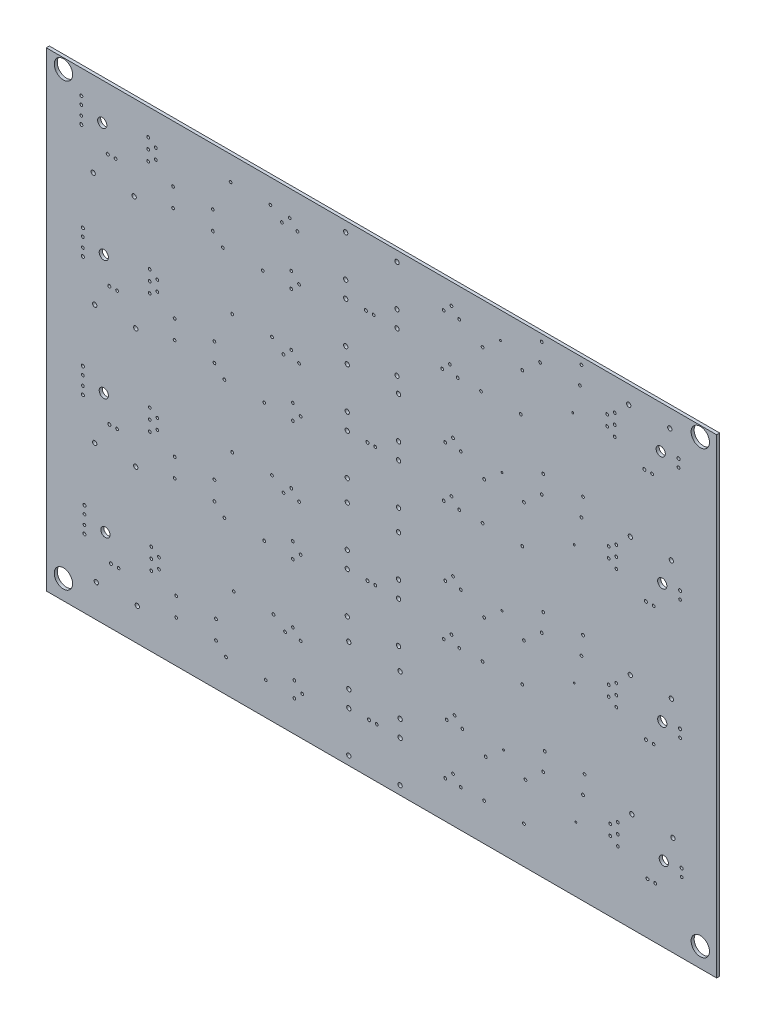
from build123d import *

# Parameters (mm, degrees)
MODEL_W             = 218.948
MODEL_H             = 153.67
MODEL_R             = 2.999999994
MODEL_R_2           = 0.30000001
MODEL_R_3           = 0.6985
MODEL_R_4           = 0.4445
MODEL_R_5           = 0.497459
MODEL_R_6           = 1.502791
MODEL_R_7           = 0.449999989
BOSS_EXTRUDE1_DEPTH = 1


with BuildPart() as part:
    # Model → Boss-Extrude1 (new body)
    with BuildSketch(Plane.XY):
        with Locations((107.188, 4.699)):
            Rectangle(MODEL_W, MODEL_H)
        with Locations((211.328, 78.232)):
            Circle(MODEL_R, mode=Mode.SUBTRACT)
        with Locations((211.328, -65.786)):
            Circle(MODEL_R, mode=Mode.SUBTRACT)
        with Locations((3.302, -65.786)):
            Circle(MODEL_R, mode=Mode.SUBTRACT)
        with Locations((3.302, 78.232)):
            Circle(MODEL_R, mode=Mode.SUBTRACT)
        with Locations((169.672, 64.262)):
            Circle(MODEL_R_2, mode=Mode.SUBTRACT)
        with Locations((146.05, 72.898)):
            Circle(MODEL_R_2, mode=Mode.SUBTRACT)
        with Locations((95.504, 46.036000003)):
            Circle(MODEL_R_3, mode=Mode.SUBTRACT)
        with Locations((95.504, 59.436)):
            Circle(MODEL_R_3, mode=Mode.SUBTRACT)
        with Locations((112.268, 46.036000003)):
            Circle(MODEL_R_3, mode=Mode.SUBTRACT)
        with Locations((112.268, 59.436)):
            Circle(MODEL_R_3, mode=Mode.SUBTRACT)
        with Locations((80.264, 55.88)):
            Circle(MODEL_R_4, mode=Mode.SUBTRACT)
        with Locations((77.724, 58.42)):
            Circle(MODEL_R_4, mode=Mode.SUBTRACT)
        with Locations((77.724, 53.34)):
            Circle(MODEL_R_4, mode=Mode.SUBTRACT)
        with Locations((129.54, 57.912)):
            Circle(MODEL_R_4, mode=Mode.SUBTRACT)
        with Locations((127, 55.372)):
            Circle(MODEL_R_4, mode=Mode.SUBTRACT)
        with Locations((132.08, 55.372)):
            Circle(MODEL_R_4, mode=Mode.SUBTRACT)
        with Locations((26.416, 53.848)):
            Circle(MODEL_R_3, mode=Mode.SUBTRACT)
        with Locations((13.016000003, 53.848)):
            Circle(MODEL_R_3, mode=Mode.SUBTRACT)
        with Locations((102.108, 59.436)):
            Circle(MODEL_R_5, mode=Mode.SUBTRACT)
        with Locations((104.648, 59.436)):
            Circle(MODEL_R_4, mode=Mode.SUBTRACT)
        with Locations((30.988000991, 69.447831996)):
            Circle(MODEL_R_4, mode=Mode.SUBTRACT)
        with Locations((30.988000991, 72.855665007)):
            Circle(MODEL_R_4, mode=Mode.SUBTRACT)
        with Locations((33.485666988, 71.141165007)):
            Circle(MODEL_R_4, mode=Mode.SUBTRACT)
        with Locations((30.988000991, 66.039999009)):
            Circle(MODEL_R_4, mode=Mode.SUBTRACT)
        with Locations((33.485666988, 67.754499009)):
            Circle(MODEL_R_4, mode=Mode.SUBTRACT)
        with Locations((15.980834002, 69.447831996)):
            Circle(MODEL_R_6, mode=Mode.SUBTRACT)
        with Locations((183.387999009, 64.304334993)):
            Circle(MODEL_R_4, mode=Mode.SUBTRACT)
        with Locations((180.890333012, 66.018834993)):
            Circle(MODEL_R_4, mode=Mode.SUBTRACT)
        with Locations((183.387999009, 71.120000991)):
            Circle(MODEL_R_4, mode=Mode.SUBTRACT)
        with Locations((180.890333012, 69.405500991)):
            Circle(MODEL_R_4, mode=Mode.SUBTRACT)
        with Locations((183.387999009, 67.712168004)):
            Circle(MODEL_R_4, mode=Mode.SUBTRACT)
        with Locations((198.395165998, 67.712168004)):
            Circle(MODEL_R_6, mode=Mode.SUBTRACT)
        with Locations((187.96, 75.692)):
            Circle(MODEL_R_3, mode=Mode.SUBTRACT)
        with Locations((201.359999997, 75.692)):
            Circle(MODEL_R_3, mode=Mode.SUBTRACT)
        with Locations((95.504, 78.232)):
            Circle(MODEL_R_3, mode=Mode.SUBTRACT)
        with Locations((95.504, 64.832000003)):
            Circle(MODEL_R_3, mode=Mode.SUBTRACT)
        with Locations((112.268, 78.232)):
            Circle(MODEL_R_3, mode=Mode.SUBTRACT)
        with Locations((112.268, 64.832000003)):
            Circle(MODEL_R_3, mode=Mode.SUBTRACT)
        with Locations((77.216, 73.152)):
            Circle(MODEL_R_4, mode=Mode.SUBTRACT)
        with Locations((74.676, 70.612)):
            Circle(MODEL_R_4, mode=Mode.SUBTRACT)
        with Locations((79.756, 70.612)):
            Circle(MODEL_R_4, mode=Mode.SUBTRACT)
        with Locations((130.048, 74.676)):
            Circle(MODEL_R_4, mode=Mode.SUBTRACT)
        with Locations((132.588, 72.136)):
            Circle(MODEL_R_4, mode=Mode.SUBTRACT)
        with Locations((127.508, 72.136)):
            Circle(MODEL_R_4, mode=Mode.SUBTRACT)
        with Locations((172.51200001, 79.248)):
            Circle(MODEL_R_7, mode=Mode.SUBTRACT)
        with Locations((159.512, 79.248)):
            Circle(MODEL_R_7, mode=Mode.SUBTRACT)
        with Locations((68.37200001, 53.848)):
            Circle(MODEL_R_7, mode=Mode.SUBTRACT)
        with Locations((55.372, 53.848)):
            Circle(MODEL_R_7, mode=Mode.SUBTRACT)
        with Locations((152.70000001, 55.372)):
            Circle(MODEL_R_7, mode=Mode.SUBTRACT)
        with Locations((139.7, 55.372)):
            Circle(MODEL_R_7, mode=Mode.SUBTRACT)
        with Locations((52.11600001, 56.896)):
            Circle(MODEL_R_7, mode=Mode.SUBTRACT)
        with Locations((39.116, 56.896)):
            Circle(MODEL_R_7, mode=Mode.SUBTRACT)
        with Locations((52.11600001, 62.992)):
            Circle(MODEL_R_7, mode=Mode.SUBTRACT)
        with Locations((39.116, 62.992)):
            Circle(MODEL_R_7, mode=Mode.SUBTRACT)
        with Locations((153.20800001, 68.072)):
            Circle(MODEL_R_7, mode=Mode.SUBTRACT)
        with Locations((140.208, 68.072)):
            Circle(MODEL_R_7, mode=Mode.SUBTRACT)
        with Locations((70.91200001, 73.66)):
            Circle(MODEL_R_7, mode=Mode.SUBTRACT)
        with Locations((57.912, 73.66)):
            Circle(MODEL_R_7, mode=Mode.SUBTRACT)
        with Locations((172.00400001, 73.152)):
            Circle(MODEL_R_7, mode=Mode.SUBTRACT)
        with Locations((159.004, 73.152)):
            Circle(MODEL_R_7, mode=Mode.SUBTRACT)
        with Locations((96.012, 8.952000003)):
            Circle(MODEL_R_3, mode=Mode.SUBTRACT)
        with Locations((96.012, 22.352)):
            Circle(MODEL_R_3, mode=Mode.SUBTRACT)
        with Locations((112.776, 8.952000003)):
            Circle(MODEL_R_3, mode=Mode.SUBTRACT)
        with Locations((112.776, 22.352)):
            Circle(MODEL_R_3, mode=Mode.SUBTRACT)
        with Locations((80.772, 18.796)):
            Circle(MODEL_R_4, mode=Mode.SUBTRACT)
        with Locations((78.232, 21.336)):
            Circle(MODEL_R_4, mode=Mode.SUBTRACT)
        with Locations((78.232, 16.256)):
            Circle(MODEL_R_4, mode=Mode.SUBTRACT)
        with Locations((68.88000001, 16.764)):
            Circle(MODEL_R_7, mode=Mode.SUBTRACT)
        with Locations((55.88, 16.764)):
            Circle(MODEL_R_7, mode=Mode.SUBTRACT)
        with Locations((130.048, 20.828)):
            Circle(MODEL_R_4, mode=Mode.SUBTRACT)
        with Locations((127.508, 18.288)):
            Circle(MODEL_R_4, mode=Mode.SUBTRACT)
        with Locations((132.588, 18.288)):
            Circle(MODEL_R_4, mode=Mode.SUBTRACT)
        with Locations((153.20800001, 18.288)):
            Circle(MODEL_R_7, mode=Mode.SUBTRACT)
        with Locations((140.208, 18.288)):
            Circle(MODEL_R_7, mode=Mode.SUBTRACT)
        with Locations((13.524000003, 16.764)):
            Circle(MODEL_R_3, mode=Mode.SUBTRACT)
        with Locations((26.924, 16.764)):
            Circle(MODEL_R_3, mode=Mode.SUBTRACT)
        with Locations((52.62400001, 19.812)):
            Circle(MODEL_R_7, mode=Mode.SUBTRACT)
        with Locations((39.624, 19.812)):
            Circle(MODEL_R_7, mode=Mode.SUBTRACT)
        with Locations((102.616, 22.352)):
            Circle(MODEL_R_5, mode=Mode.SUBTRACT)
        with Locations((105.156, 22.352)):
            Circle(MODEL_R_4, mode=Mode.SUBTRACT)
        with Locations((18.288, 24.384)):
            Circle(MODEL_R_5, mode=Mode.SUBTRACT)
        with Locations((20.828, 24.384)):
            Circle(MODEL_R_4, mode=Mode.SUBTRACT)
        with Locations((52.62400001, 25.908)):
            Circle(MODEL_R_7, mode=Mode.SUBTRACT)
        with Locations((39.624, 25.908)):
            Circle(MODEL_R_7, mode=Mode.SUBTRACT)
        with Locations((31.496000991, 32.363831996)):
            Circle(MODEL_R_4, mode=Mode.SUBTRACT)
        with Locations((31.496000991, 35.771665007)):
            Circle(MODEL_R_4, mode=Mode.SUBTRACT)
        with Locations((33.993666988, 34.057165007)):
            Circle(MODEL_R_4, mode=Mode.SUBTRACT)
        with Locations((31.496000991, 28.955999009)):
            Circle(MODEL_R_4, mode=Mode.SUBTRACT)
        with Locations((33.993666988, 30.670499009)):
            Circle(MODEL_R_4, mode=Mode.SUBTRACT)
        with Locations((16.488834002, 32.363831996)):
            Circle(MODEL_R_6, mode=Mode.SUBTRACT)
        with Locations((96.012, 27.748000003)):
            Circle(MODEL_R_3, mode=Mode.SUBTRACT)
        with Locations((96.012, 41.148)):
            Circle(MODEL_R_3, mode=Mode.SUBTRACT)
        with Locations((112.776, 27.748000003)):
            Circle(MODEL_R_3, mode=Mode.SUBTRACT)
        with Locations((112.776, 41.148)):
            Circle(MODEL_R_3, mode=Mode.SUBTRACT)
        with Locations((170.18, 27.178)):
            Circle(MODEL_R_2, mode=Mode.SUBTRACT)
        with Locations((183.895999009, 27.220334993)):
            Circle(MODEL_R_4, mode=Mode.SUBTRACT)
        with Locations((181.398333012, 28.934834993)):
            Circle(MODEL_R_4, mode=Mode.SUBTRACT)
        with Locations((183.895999009, 34.036000991)):
            Circle(MODEL_R_4, mode=Mode.SUBTRACT)
        with Locations((181.398333012, 32.321500991)):
            Circle(MODEL_R_4, mode=Mode.SUBTRACT)
        with Locations((183.895999009, 30.628168004)):
            Circle(MODEL_R_4, mode=Mode.SUBTRACT)
        with Locations((198.903165998, 30.628168004)):
            Circle(MODEL_R_6, mode=Mode.SUBTRACT)
        with Locations((77.724, 36.068)):
            Circle(MODEL_R_4, mode=Mode.SUBTRACT)
        with Locations((75.184, 33.528)):
            Circle(MODEL_R_4, mode=Mode.SUBTRACT)
        with Locations((80.264, 33.528)):
            Circle(MODEL_R_4, mode=Mode.SUBTRACT)
        with Locations((153.71600001, 30.988)):
            Circle(MODEL_R_7, mode=Mode.SUBTRACT)
        with Locations((140.716, 30.988)):
            Circle(MODEL_R_7, mode=Mode.SUBTRACT)
        with Locations((128.016, 35.052)):
            Circle(MODEL_R_4, mode=Mode.SUBTRACT)
        with Locations((130.556, 37.592)):
            Circle(MODEL_R_4, mode=Mode.SUBTRACT)
        with Locations((133.096, 35.052)):
            Circle(MODEL_R_4, mode=Mode.SUBTRACT)
        with Locations((9.652, 34.036)):
            Circle(MODEL_R_4, mode=Mode.SUBTRACT)
        with Locations((9.652, 36.576)):
            Circle(MODEL_R_5, mode=Mode.SUBTRACT)
        with Locations((172.51200001, 36.068)):
            Circle(MODEL_R_7, mode=Mode.SUBTRACT)
        with Locations((159.512, 36.068)):
            Circle(MODEL_R_7, mode=Mode.SUBTRACT)
        with Locations((71.42000001, 36.576)):
            Circle(MODEL_R_7, mode=Mode.SUBTRACT)
        with Locations((58.42, 36.576)):
            Circle(MODEL_R_7, mode=Mode.SUBTRACT)
        with Locations((146.558, 35.814)):
            Circle(MODEL_R_2, mode=Mode.SUBTRACT)
        with Locations((188.468, 38.608)):
            Circle(MODEL_R_3, mode=Mode.SUBTRACT)
        with Locations((201.867999997, 38.608)):
            Circle(MODEL_R_3, mode=Mode.SUBTRACT)
        with Locations((173.02000001, 42.164)):
            Circle(MODEL_R_7, mode=Mode.SUBTRACT)
        with Locations((160.02, 42.164)):
            Circle(MODEL_R_7, mode=Mode.SUBTRACT)
        with Locations((96.012, -30.163999997)):
            Circle(MODEL_R_3, mode=Mode.SUBTRACT)
        with Locations((96.012, -16.764)):
            Circle(MODEL_R_3, mode=Mode.SUBTRACT)
        with Locations((112.776, -30.163999997)):
            Circle(MODEL_R_3, mode=Mode.SUBTRACT)
        with Locations((112.776, -16.764)):
            Circle(MODEL_R_3, mode=Mode.SUBTRACT)
        with Locations((80.772, -20.32)):
            Circle(MODEL_R_4, mode=Mode.SUBTRACT)
        with Locations((78.232, -17.78)):
            Circle(MODEL_R_4, mode=Mode.SUBTRACT)
        with Locations((78.232, -22.86)):
            Circle(MODEL_R_4, mode=Mode.SUBTRACT)
        with Locations((68.88000001, -22.352)):
            Circle(MODEL_R_7, mode=Mode.SUBTRACT)
        with Locations((55.88, -22.352)):
            Circle(MODEL_R_7, mode=Mode.SUBTRACT)
        with Locations((130.048, -18.288)):
            Circle(MODEL_R_4, mode=Mode.SUBTRACT)
        with Locations((127.508, -20.828)):
            Circle(MODEL_R_4, mode=Mode.SUBTRACT)
        with Locations((132.588, -20.828)):
            Circle(MODEL_R_4, mode=Mode.SUBTRACT)
        with Locations((153.20800001, -20.828)):
            Circle(MODEL_R_7, mode=Mode.SUBTRACT)
        with Locations((140.208, -20.828)):
            Circle(MODEL_R_7, mode=Mode.SUBTRACT)
        with Locations((13.524000003, -22.352)):
            Circle(MODEL_R_3, mode=Mode.SUBTRACT)
        with Locations((26.924, -22.352)):
            Circle(MODEL_R_3, mode=Mode.SUBTRACT)
        with Locations((52.62400001, -19.304)):
            Circle(MODEL_R_7, mode=Mode.SUBTRACT)
        with Locations((39.624, -19.304)):
            Circle(MODEL_R_7, mode=Mode.SUBTRACT)
        with Locations((102.616, -16.764)):
            Circle(MODEL_R_5, mode=Mode.SUBTRACT)
        with Locations((105.156, -16.764)):
            Circle(MODEL_R_4, mode=Mode.SUBTRACT)
        with Locations((18.288, -14.732)):
            Circle(MODEL_R_5, mode=Mode.SUBTRACT)
        with Locations((20.828, -14.732)):
            Circle(MODEL_R_4, mode=Mode.SUBTRACT)
        with Locations((52.62400001, -13.208)):
            Circle(MODEL_R_7, mode=Mode.SUBTRACT)
        with Locations((39.624, -13.208)):
            Circle(MODEL_R_7, mode=Mode.SUBTRACT)
        with Locations((31.496000991, -6.752168004)):
            Circle(MODEL_R_4, mode=Mode.SUBTRACT)
        with Locations((31.496000991, -3.344334993)):
            Circle(MODEL_R_4, mode=Mode.SUBTRACT)
        with Locations((33.993666988, -5.058834993)):
            Circle(MODEL_R_4, mode=Mode.SUBTRACT)
        with Locations((31.496000991, -10.160000991)):
            Circle(MODEL_R_4, mode=Mode.SUBTRACT)
        with Locations((33.993666988, -8.445500991)):
            Circle(MODEL_R_4, mode=Mode.SUBTRACT)
        with Locations((16.488834002, -6.752168004)):
            Circle(MODEL_R_6, mode=Mode.SUBTRACT)
        with Locations((96.012, -11.367999997)):
            Circle(MODEL_R_3, mode=Mode.SUBTRACT)
        with Locations((96.012, 2.032)):
            Circle(MODEL_R_3, mode=Mode.SUBTRACT)
        with Locations((112.776, -11.367999997)):
            Circle(MODEL_R_3, mode=Mode.SUBTRACT)
        with Locations((112.776, 2.032)):
            Circle(MODEL_R_3, mode=Mode.SUBTRACT)
        with Locations((170.18, -11.938)):
            Circle(MODEL_R_2, mode=Mode.SUBTRACT)
        with Locations((183.895999009, -11.895665007)):
            Circle(MODEL_R_4, mode=Mode.SUBTRACT)
        with Locations((181.398333012, -10.181165007)):
            Circle(MODEL_R_4, mode=Mode.SUBTRACT)
        with Locations((183.895999009, -5.079999009)):
            Circle(MODEL_R_4, mode=Mode.SUBTRACT)
        with Locations((181.398333012, -6.794499009)):
            Circle(MODEL_R_4, mode=Mode.SUBTRACT)
        with Locations((183.895999009, -8.487831996)):
            Circle(MODEL_R_4, mode=Mode.SUBTRACT)
        with Locations((198.903165998, -8.487831996)):
            Circle(MODEL_R_6, mode=Mode.SUBTRACT)
        with Locations((77.724, -3.048)):
            Circle(MODEL_R_4, mode=Mode.SUBTRACT)
        with Locations((75.184, -5.588)):
            Circle(MODEL_R_4, mode=Mode.SUBTRACT)
        with Locations((80.264, -5.588)):
            Circle(MODEL_R_4, mode=Mode.SUBTRACT)
        with Locations((153.71600001, -8.128)):
            Circle(MODEL_R_7, mode=Mode.SUBTRACT)
        with Locations((140.716, -8.128)):
            Circle(MODEL_R_7, mode=Mode.SUBTRACT)
        with Locations((128.016, -4.064)):
            Circle(MODEL_R_4, mode=Mode.SUBTRACT)
        with Locations((130.556, -1.524)):
            Circle(MODEL_R_4, mode=Mode.SUBTRACT)
        with Locations((133.096, -4.064)):
            Circle(MODEL_R_4, mode=Mode.SUBTRACT)
        with Locations((9.652, -5.08)):
            Circle(MODEL_R_4, mode=Mode.SUBTRACT)
        with Locations((9.652, -2.54)):
            Circle(MODEL_R_5, mode=Mode.SUBTRACT)
        with Locations((172.51200001, -3.048)):
            Circle(MODEL_R_7, mode=Mode.SUBTRACT)
        with Locations((159.512, -3.048)):
            Circle(MODEL_R_7, mode=Mode.SUBTRACT)
        with Locations((71.42000001, -2.54)):
            Circle(MODEL_R_7, mode=Mode.SUBTRACT)
        with Locations((58.42, -2.54)):
            Circle(MODEL_R_7, mode=Mode.SUBTRACT)
        with Locations((146.558, -3.302)):
            Circle(MODEL_R_2, mode=Mode.SUBTRACT)
        with Locations((188.468, -0.508)):
            Circle(MODEL_R_3, mode=Mode.SUBTRACT)
        with Locations((201.867999997, -0.508)):
            Circle(MODEL_R_3, mode=Mode.SUBTRACT)
        with Locations((173.02000001, 3.048)):
            Circle(MODEL_R_7, mode=Mode.SUBTRACT)
        with Locations((160.02, 3.048)):
            Circle(MODEL_R_7, mode=Mode.SUBTRACT)
        with Locations((96.52, -69.279999997)):
            Circle(MODEL_R_3, mode=Mode.SUBTRACT)
        with Locations((96.52, -55.88)):
            Circle(MODEL_R_3, mode=Mode.SUBTRACT)
        with Locations((113.284, -69.279999997)):
            Circle(MODEL_R_3, mode=Mode.SUBTRACT)
        with Locations((113.284, -55.88)):
            Circle(MODEL_R_3, mode=Mode.SUBTRACT)
        with Locations((81.28, -59.436)):
            Circle(MODEL_R_4, mode=Mode.SUBTRACT)
        with Locations((78.74, -56.896)):
            Circle(MODEL_R_4, mode=Mode.SUBTRACT)
        with Locations((78.74, -61.976)):
            Circle(MODEL_R_4, mode=Mode.SUBTRACT)
        with Locations((69.38800001, -61.468)):
            Circle(MODEL_R_7, mode=Mode.SUBTRACT)
        with Locations((56.388, -61.468)):
            Circle(MODEL_R_7, mode=Mode.SUBTRACT)
        with Locations((130.556, -57.404)):
            Circle(MODEL_R_4, mode=Mode.SUBTRACT)
        with Locations((128.016, -59.944)):
            Circle(MODEL_R_4, mode=Mode.SUBTRACT)
        with Locations((133.096, -59.944)):
            Circle(MODEL_R_4, mode=Mode.SUBTRACT)
        with Locations((153.71600001, -59.944)):
            Circle(MODEL_R_7, mode=Mode.SUBTRACT)
        with Locations((140.716, -59.944)):
            Circle(MODEL_R_7, mode=Mode.SUBTRACT)
        with Locations((14.032000003, -61.468)):
            Circle(MODEL_R_3, mode=Mode.SUBTRACT)
        with Locations((27.432, -61.468)):
            Circle(MODEL_R_3, mode=Mode.SUBTRACT)
        with Locations((53.13200001, -58.42)):
            Circle(MODEL_R_7, mode=Mode.SUBTRACT)
        with Locations((40.132, -58.42)):
            Circle(MODEL_R_7, mode=Mode.SUBTRACT)
        with Locations((53.13200001, -52.324)):
            Circle(MODEL_R_7, mode=Mode.SUBTRACT)
        with Locations((40.132, -52.324)):
            Circle(MODEL_R_7, mode=Mode.SUBTRACT)
        with Locations((32.004000991, -45.868168004)):
            Circle(MODEL_R_4, mode=Mode.SUBTRACT)
        with Locations((32.004000991, -42.460334993)):
            Circle(MODEL_R_4, mode=Mode.SUBTRACT)
        with Locations((34.501666988, -44.174834993)):
            Circle(MODEL_R_4, mode=Mode.SUBTRACT)
        with Locations((32.004000991, -49.276000991)):
            Circle(MODEL_R_4, mode=Mode.SUBTRACT)
        with Locations((34.501666988, -47.561500991)):
            Circle(MODEL_R_4, mode=Mode.SUBTRACT)
        with Locations((16.996834002, -45.868168004)):
            Circle(MODEL_R_6, mode=Mode.SUBTRACT)
        with Locations((96.52, -50.483999997)):
            Circle(MODEL_R_3, mode=Mode.SUBTRACT)
        with Locations((96.52, -37.084)):
            Circle(MODEL_R_3, mode=Mode.SUBTRACT)
        with Locations((113.284, -50.483999997)):
            Circle(MODEL_R_3, mode=Mode.SUBTRACT)
        with Locations((113.284, -37.084)):
            Circle(MODEL_R_3, mode=Mode.SUBTRACT)
        with Locations((170.688, -51.054)):
            Circle(MODEL_R_2, mode=Mode.SUBTRACT)
        with Locations((184.403999009, -51.011665007)):
            Circle(MODEL_R_4, mode=Mode.SUBTRACT)
        with Locations((181.906333012, -49.297165007)):
            Circle(MODEL_R_4, mode=Mode.SUBTRACT)
        with Locations((184.403999009, -44.195999009)):
            Circle(MODEL_R_4, mode=Mode.SUBTRACT)
        with Locations((181.906333012, -45.910499009)):
            Circle(MODEL_R_4, mode=Mode.SUBTRACT)
        with Locations((184.403999009, -47.603831996)):
            Circle(MODEL_R_4, mode=Mode.SUBTRACT)
        with Locations((199.411165998, -47.603831996)):
            Circle(MODEL_R_6, mode=Mode.SUBTRACT)
        with Locations((78.232, -42.164)):
            Circle(MODEL_R_4, mode=Mode.SUBTRACT)
        with Locations((75.692, -44.704)):
            Circle(MODEL_R_4, mode=Mode.SUBTRACT)
        with Locations((80.772, -44.704)):
            Circle(MODEL_R_4, mode=Mode.SUBTRACT)
        with Locations((154.22400001, -47.244)):
            Circle(MODEL_R_7, mode=Mode.SUBTRACT)
        with Locations((141.224, -47.244)):
            Circle(MODEL_R_7, mode=Mode.SUBTRACT)
        with Locations((128.524, -43.18)):
            Circle(MODEL_R_4, mode=Mode.SUBTRACT)
        with Locations((131.064, -40.64)):
            Circle(MODEL_R_4, mode=Mode.SUBTRACT)
        with Locations((133.604, -43.18)):
            Circle(MODEL_R_4, mode=Mode.SUBTRACT)
        with Locations((173.02000001, -42.164)):
            Circle(MODEL_R_7, mode=Mode.SUBTRACT)
        with Locations((160.02, -42.164)):
            Circle(MODEL_R_7, mode=Mode.SUBTRACT)
        with Locations((71.92800001, -41.656)):
            Circle(MODEL_R_7, mode=Mode.SUBTRACT)
        with Locations((58.928, -41.656)):
            Circle(MODEL_R_7, mode=Mode.SUBTRACT)
        with Locations((147.066, -42.418)):
            Circle(MODEL_R_2, mode=Mode.SUBTRACT)
        with Locations((188.976, -39.624)):
            Circle(MODEL_R_3, mode=Mode.SUBTRACT)
        with Locations((202.375999997, -39.624)):
            Circle(MODEL_R_3, mode=Mode.SUBTRACT)
        with Locations((173.52800001, -36.068)):
            Circle(MODEL_R_7, mode=Mode.SUBTRACT)
        with Locations((160.528, -36.068)):
            Circle(MODEL_R_7, mode=Mode.SUBTRACT)
        with Locations((103.124, -55.88)):
            Circle(MODEL_R_5, mode=Mode.SUBTRACT)
        with Locations((105.664, -55.88)):
            Circle(MODEL_R_4, mode=Mode.SUBTRACT)
        with Locations((10.16, -44.196)):
            Circle(MODEL_R_4, mode=Mode.SUBTRACT)
        with Locations((10.16, -41.656)):
            Circle(MODEL_R_5, mode=Mode.SUBTRACT)
        with Locations((18.796, -53.848)):
            Circle(MODEL_R_5, mode=Mode.SUBTRACT)
        with Locations((21.336, -53.848)):
            Circle(MODEL_R_4, mode=Mode.SUBTRACT)
        with Locations((196.596, -55.372)):
            Circle(MODEL_R_4, mode=Mode.SUBTRACT)
        with Locations((194.056, -55.372)):
            Circle(MODEL_R_5, mode=Mode.SUBTRACT)
        with Locations((205.232, -49.276)):
            Circle(MODEL_R_4, mode=Mode.SUBTRACT)
        with Locations((205.232, -46.736)):
            Circle(MODEL_R_5, mode=Mode.SUBTRACT)
        with Locations((196.088, -16.256)):
            Circle(MODEL_R_4, mode=Mode.SUBTRACT)
        with Locations((193.548, -16.256)):
            Circle(MODEL_R_5, mode=Mode.SUBTRACT)
        with Locations((204.724, -10.16)):
            Circle(MODEL_R_4, mode=Mode.SUBTRACT)
        with Locations((204.724, -7.62)):
            Circle(MODEL_R_5, mode=Mode.SUBTRACT)
        with Locations((204.724, 28.956)):
            Circle(MODEL_R_4, mode=Mode.SUBTRACT)
        with Locations((204.724, 31.496)):
            Circle(MODEL_R_5, mode=Mode.SUBTRACT)
        with Locations((196.088, 22.86)):
            Circle(MODEL_R_4, mode=Mode.SUBTRACT)
        with Locations((193.548, 22.86)):
            Circle(MODEL_R_5, mode=Mode.SUBTRACT)
        with Locations((9.144, 71.12)):
            Circle(MODEL_R_4, mode=Mode.SUBTRACT)
        with Locations((9.144, 73.66)):
            Circle(MODEL_R_5, mode=Mode.SUBTRACT)
        with Locations((17.78, 61.468)):
            Circle(MODEL_R_5, mode=Mode.SUBTRACT)
        with Locations((20.32, 61.468)):
            Circle(MODEL_R_4, mode=Mode.SUBTRACT)
        with Locations((195.58, 59.944)):
            Circle(MODEL_R_4, mode=Mode.SUBTRACT)
        with Locations((193.04, 59.944)):
            Circle(MODEL_R_5, mode=Mode.SUBTRACT)
        with Locations((204.216, 66.04)):
            Circle(MODEL_R_4, mode=Mode.SUBTRACT)
        with Locations((204.216, 68.58)):
            Circle(MODEL_R_5, mode=Mode.SUBTRACT)
        with Locations((10.16, -47.244)):
            Circle(MODEL_R_4, mode=Mode.SUBTRACT)
        with Locations((10.16, -49.784)):
            Circle(MODEL_R_5, mode=Mode.SUBTRACT)
        with Locations((9.652, -8.128)):
            Circle(MODEL_R_4, mode=Mode.SUBTRACT)
        with Locations((9.652, -10.668)):
            Circle(MODEL_R_5, mode=Mode.SUBTRACT)
        with Locations((9.652, 30.988)):
            Circle(MODEL_R_4, mode=Mode.SUBTRACT)
        with Locations((9.652, 28.448)):
            Circle(MODEL_R_5, mode=Mode.SUBTRACT)
        with Locations((9.144, 68.072)):
            Circle(MODEL_R_4, mode=Mode.SUBTRACT)
        with Locations((9.144, 65.532)):
            Circle(MODEL_R_5, mode=Mode.SUBTRACT)
    extrude(amount=BOSS_EXTRUDE1_DEPTH)


solid = part.part
